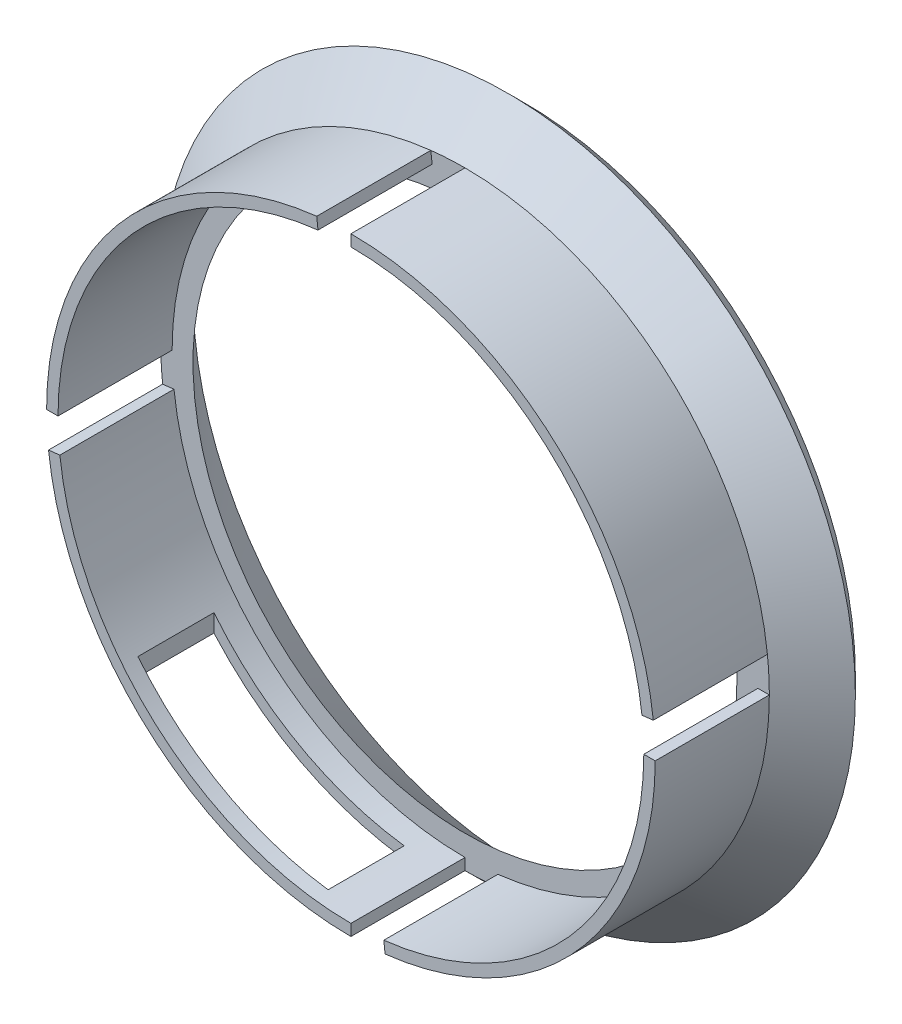
from build123d import *

# Parameters (mm, degrees)
SALIENTE_EXTRUIR1_DEPTH    = 15
SALIENTE_EXTRUIR1_2_DEPTH  = 15
SALIENTE_EXTRUIR1_3_DEPTH  = 15
SALIENTE_EXTRUIR1_4_DEPTH  = 15
CORTAR_EXTRUIR1_REACH      = 68.288
CORTAR_EXTRUIR1_END_RADIUS = 40
CROQUIS3_W                 = 25
CROQUIS3_H                 = 10


with BuildPart() as part:
    # Croquis1 → Saliente-Extruir1 (new body)
    with BuildSketch(Plane.XY):
        with BuildLine():
            Line((-4.324392398, 38.256367187), (-4.492875219, 39.746875))
            ThreePointArc((-4.492875219, 39.746875), (-29.830479453, 26.648498937), (-40, 0))
            Line((-40, 0), (-38.5, 0))
            ThreePointArc((-38.5, 0), (-28.711836473, 25.649180227), (-4.324392398, 38.256367187))
        make_face()
    extrude(amount=SALIENTE_EXTRUIR1_DEPTH)



with BuildPart() as body_2:
    # Croquis1 → Saliente-Extruir1 2 (new body)
    with BuildSketch(Plane.XY):
        with BuildLine():
            Line((-38.256367187, -4.324392398), (-39.746875, -4.492875219))
            ThreePointArc((-39.746875, -4.492875219), (-26.648498937, -29.830479453), (0, -40))
            Line((0, -40), (0, -38.5))
            ThreePointArc((0, -38.5), (-25.649180227, -28.711836473), (-38.256367187, -4.324392398))
        make_face()
    extrude(amount=SALIENTE_EXTRUIR1_2_DEPTH)


with BuildPart() as body_3:
    # Croquis1 → Saliente-Extruir1 3 (new body)
    with BuildSketch(Plane.XY):
        with BuildLine():
            ThreePointArc((39.746875, 4.492875219), (26.648498937, 29.830479453), (0, 40))
            Line((0, 40), (0, 38.5))
            ThreePointArc((0, 38.5), (25.649180227, 28.711836473), (38.256367187, 4.324392398))
            Line((38.256367188, 4.324392398), (39.746875, 4.492875219))
        make_face()
    extrude(amount=SALIENTE_EXTRUIR1_3_DEPTH)


with BuildPart() as body_4:
    # Croquis1 → Saliente-Extruir1 4 (new body)
    with BuildSketch(Plane.XY):
        with BuildLine():
            ThreePointArc((4.492875219, -39.746875), (29.830479453, -26.648498937), (40, 0))
            Line((40, 0), (38.5, 0))
            ThreePointArc((38.5, 0), (28.711836473, -25.649180227), (4.324392398, -38.256367188))
            Line((4.324392398, -38.256367188), (4.492875219, -39.746875))
        make_face()
    extrude(amount=SALIENTE_EXTRUIR1_4_DEPTH)


with BuildPart() as part_1:
    add(part.part)

    add(body_2.part)  # Revolución1 merges body 2

    add(body_3.part)  # Revolución1 merges body 3

    add(body_4.part)  # Revolución1 merges body 4
    # Croquis2 → Revolución1 (revolve)
    with BuildSketch(Plane(origin=(0, 0, 0), x_dir=(1, 0, 0), z_dir=(0, 1, 0)), mode=Mode.PRIVATE) as revoluci_n1_sk:
        Polygon((-40, 0), (-45.656854249, 5.656854249), (-43.535533906, 7.778174593), (-35.757359313, 0), align=None)
    revolve(revoluci_n1_sk.sketch.rotate(Axis((0, 0, 0), (0, 0, -1)), 180), axis=Axis((0, 0, 0), (0, 0, -1)))

    # Cortar-Extruir1: up to this cylinder (the profile starts inside it)
    cortar_extruir1_end = Plane(origin=(0, 0, 8), z_dir=(0, 0, -1)) * Cylinder(CORTAR_EXTRUIR1_END_RADIUS, 217.576, mode=Mode.PRIVATE)
    # Croquis3 → Cortar-Extruir1 (cut, up to the surface)
    with BuildSketch(Plane(origin=(0, 0, 0), x_dir=(1, 0, 0), z_dir=(0, 1, 0)), mode=Mode.PRIVATE) as cortar_extruir1_sk1:
        with Locations((-17.5, -8)):
            Rectangle(CROQUIS3_W, CROQUIS3_H)
    cortar_extruir1_tool1 = extrude(cortar_extruir1_sk1.sketch, amount=-CORTAR_EXTRUIR1_REACH, mode=Mode.PRIVATE) & cortar_extruir1_end
    add(cortar_extruir1_tool1.solids().sort_by_distance((-17.5, 0, 8))[0], mode=Mode.SUBTRACT)


solid = part_1.part
